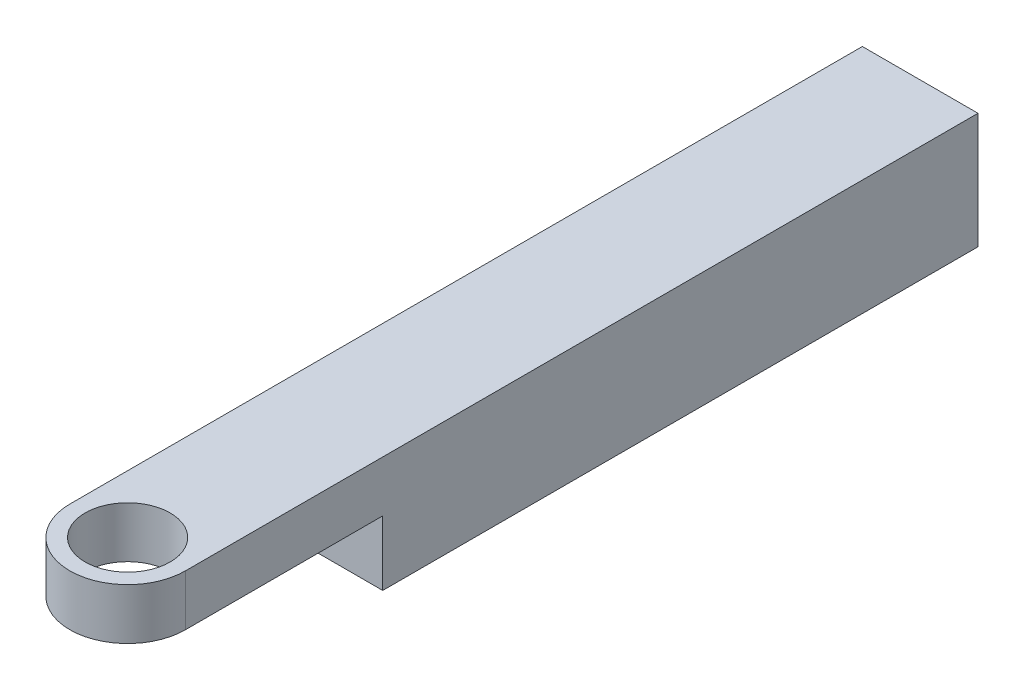
from build123d import *

# Parameters (mm, degrees)
SKETCH1_W           = 6.8
SKETCH1_H           = 6.8
SKETCH1_R           = 1.75
BOSS_EXTRUDE1_DEPTH = 50
CUT_EXTRUDE1_DEPTH  = 8
SKETCH5_W           = 6.8
SKETCH5_H           = 6.8
BOSS_EXTRUDE2_DEPTH = 7
SKETCH3_W           = 6.8
SKETCH3_H           = 3.8
CUT_EXTRUDE2_DEPTH  = 15
SKETCH4_R           = 2.5
CUT_EXTRUDE3_DEPTH  = 20
FILLET3_RADIUS      = 3.4
FILLET3_LENGTH      = 3


with BuildPart() as part:
    # Sketch1 → Boss-Extrude1 (new body)
    with BuildSketch(Plane.XY):
        with Locations((-3.4, 3.4)):
            Rectangle(SKETCH1_W, SKETCH1_H)
        with Locations((-3.4, 3.4)):
            Circle(SKETCH1_R, mode=Mode.SUBTRACT)
    extrude(amount=BOSS_EXTRUDE1_DEPTH)

    # Sketch2 → Cut-Extrude1 (cut)
    with BuildSketch(Plane(origin=(0, 0, 0), x_dir=(-1, 0, 0), z_dir=(0, 0, -1))):
        Polygon((6.575426481, 3.4), (4.98771324, 6.15), (1.81228676, 6.15), (0.224573519, 3.4), (1.81228676, 0.65), (4.98771324, 0.65), align=None)
    extrude(amount=-CUT_EXTRUDE1_DEPTH, mode=Mode.SUBTRACT)

    # Sketch5 → Boss-Extrude2 (add)
    with BuildSketch(Plane.XY.offset(50)):
        with Locations((-3.4, 3.4)):
            Rectangle(SKETCH5_W, SKETCH5_H)
    extrude(amount=-BOSS_EXTRUDE2_DEPTH)

    # Sketch3 → Cut-Extrude2 (cut)
    with BuildSketch(Plane.XY.offset(50)):
        with Locations((-3.4, 1.9)):
            Rectangle(SKETCH3_W, SKETCH3_H)
    extrude(amount=-CUT_EXTRUDE2_DEPTH, mode=Mode.SUBTRACT)

    # Sketch4 → Cut-Extrude3 (cut)
    with BuildSketch(Plane.XZ.offset(-3.8)):
        with Locations((-3.4, 46.6)):
            Circle(SKETCH4_R)
    extrude(amount=-CUT_EXTRUDE3_DEPTH, mode=Mode.SUBTRACT)

    # Fillet3: full round fillet: the end face becomes a half cylinder, R = half its width
    fillet3_face = Plane((-3.4, 5.3, 50), x_dir=(0, -1, 0), z_dir=(0, 0, 1))  # on the end face: x along it, z out of the body
    fillet3_slab = fillet3_face.offset(-FILLET3_RADIUS / 2) * Box(FILLET3_LENGTH, 2 * FILLET3_RADIUS, FILLET3_RADIUS, mode=Mode.PRIVATE)  # the body's end, R deep
    fillet3_round = Plane((-3.4, 5.3, 46.6), x_dir=(0, 0, 1), z_dir=(0, -1, 0)) * Cylinder(FILLET3_RADIUS, FILLET3_LENGTH, mode=Mode.PRIVATE)  # its axis R under the face
    add(fillet3_slab - fillet3_round, mode=Mode.SUBTRACT)


solid = part.part
